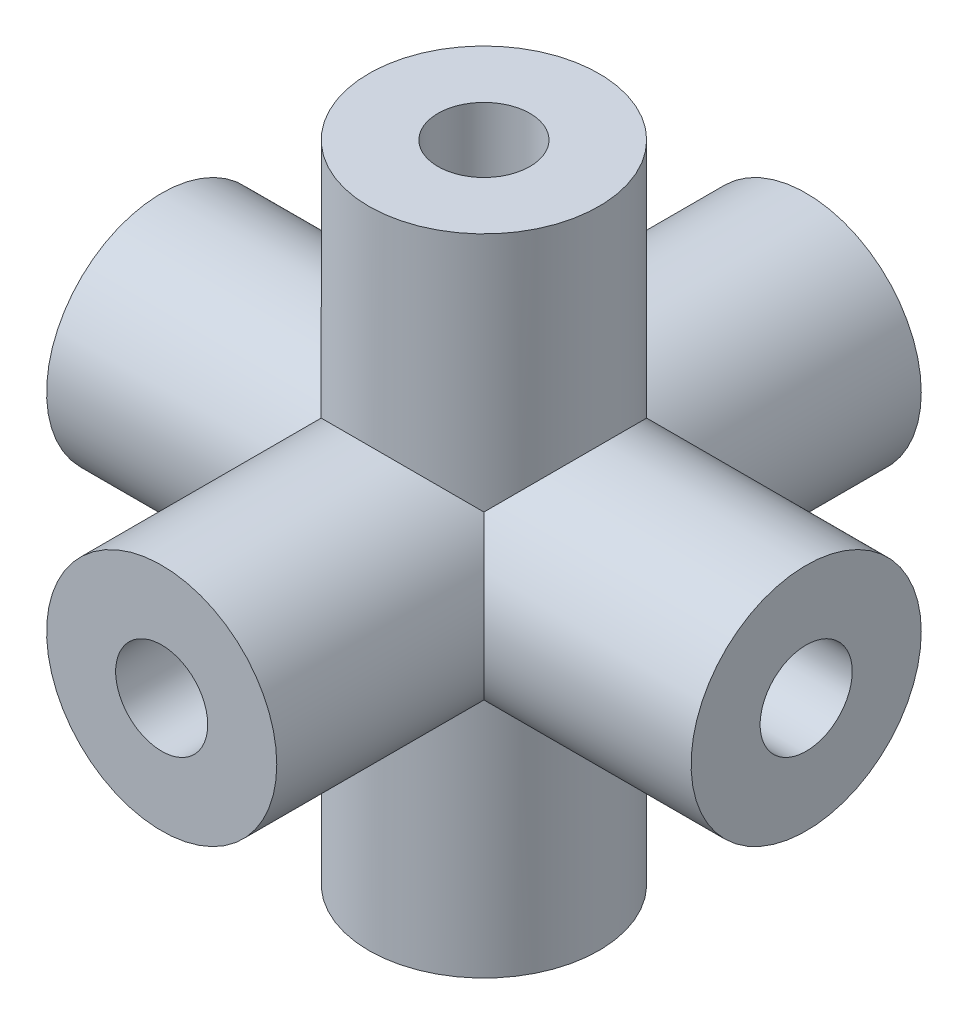
from build123d import *

# Parameters (mm, degrees)
SKETCH1_R           = 2.5
BASE_EXTRUDE_DEPTH  = 7
SKETCH2_R           = 2.5
BOSS_EXTRUDE3_DEPTH = 7
SKETCH3_R           = 2.5
BOSS_EXTRUDE4_DEPTH = 7
SKETCH8_R           = 1
CUT_EXTRUDE2_DEPTH  = 3
CIRPATTERN4_COUNT   = 4
CIRPATTERN5_COUNT   = 4


with BuildPart() as part:
    # Sketch1 → Base-Extrude (new, symmetric)
    with BuildSketch(Plane.XY):
        with Locations(Location((0, 0, 0), (0, 0, 225))):
            Circle(SKETCH1_R)
    extrude(amount=BASE_EXTRUDE_DEPTH, both=True)

    # Sketch2 → Boss-Extrude3 (add, symmetric)
    with BuildSketch(Plane(origin=(0, 0, 0), x_dir=(1, 0, 0), z_dir=(0, 1, 0))):
        with Locations(Location((0, 0, 0), (0, 0, 135))):
            Circle(SKETCH2_R)
    extrude(amount=BOSS_EXTRUDE3_DEPTH, both=True)

    # Sketch3 → Boss-Extrude4 (add, symmetric)
    with BuildSketch(Plane(origin=(0, 0, 0), x_dir=(0, 0, -1), z_dir=(1, 0, 0))):
        with Locations(Location((0, 0, 0), (0, 0, 225))):
            Circle(SKETCH3_R)
    extrude(amount=BOSS_EXTRUDE4_DEPTH, both=True)

    # Sketch8 → Cut-Extrude2 (cut)
    with BuildSketch(Plane(origin=(7, 0, 0), x_dir=(0, 0, -1), z_dir=(1, 0, 0))):
        Circle(SKETCH8_R)
    cut_extrude2 = extrude(amount=-CUT_EXTRUDE2_DEPTH, mode=Mode.SUBTRACT)

    # CirPattern4: Cut-Extrude2 ×4 about axis
    cirpattern4_axis = Axis((0, 0, 0), (0, 1, 0))
    for i in range(1, CIRPATTERN4_COUNT):
        add(cut_extrude2.rotate(cirpattern4_axis, i * 360 / CIRPATTERN4_COUNT), mode=Mode.SUBTRACT)

    # CirPattern5: Cut-Extrude2 ×4 about axis
    cirpattern5_axis = Axis((0, 0, 0), (0, 0, 1))
    for i in range(1, CIRPATTERN5_COUNT):
        add(cut_extrude2.rotate(cirpattern5_axis, i * 360 / CIRPATTERN5_COUNT), mode=Mode.SUBTRACT)


solid = part.part
